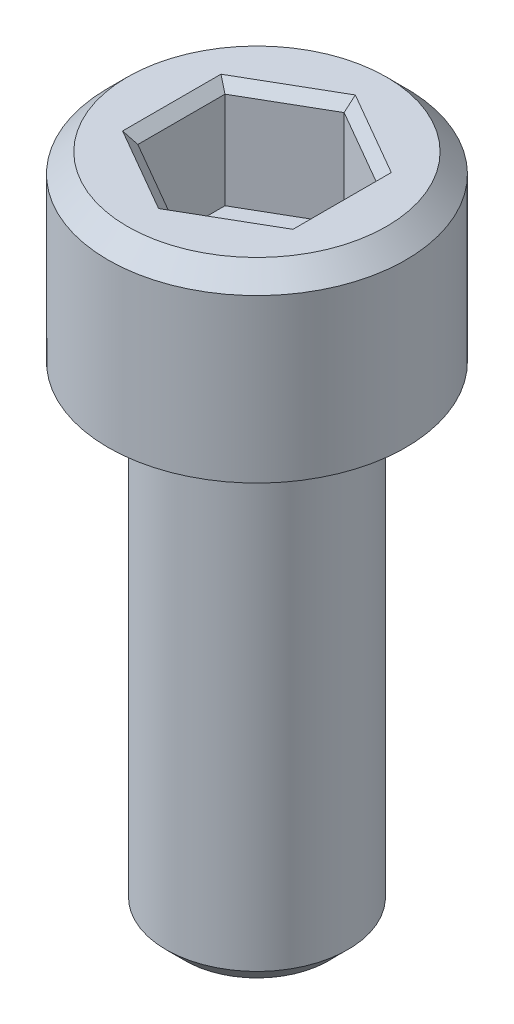
from build123d import *

# Parameters (mm, degrees)
SKETCH1_W           = 3.9116
SKETCH1_H           = 4.7752
SKETCH2_R           = 2.3876
BOSS_EXTRUDE1_DEPTH = 12.7
CUT_EXTRUDE1_DEPTH  = 2.794
CHAMFER1_SIZE       = 0.508
CHAMFER2_SIZE       = 0.254


with BuildPart() as part:
    # Sketch1 → Revolve1 (revolve)
    with BuildSketch(Plane.XY, mode=Mode.PRIVATE) as revolve1_sk:
        with Locations((-1.9558, -2.3876)):
            Rectangle(SKETCH1_W, SKETCH1_H)
    revolve(revolve1_sk.sketch.rotate(Axis((0, -4.7752, 0), (0, 1, 0)), 90), axis=Axis((0, -4.7752, 0), (0, 1, 0)))

    # Sketch2 → Boss-Extrude1 (add)
    with BuildSketch(Plane.XZ.offset(4.7752)):
        with Locations(Location((0, 0, 0), (0, 0, 270))):
            Circle(SKETCH2_R)
    extrude(amount=BOSS_EXTRUDE1_DEPTH)

    # Sketch3 → Cut-Extrude1 (cut)
    with BuildSketch(Plane(origin=(0, 0, 0), x_dir=(-1, 0, 0), z_dir=(0, 1, 0))):
        Polygon((1.984374999, -1.14567944), (1.984374999, 1.14567944), (0, 2.29135888), (-1.984374999, 1.14567944), (-1.984374999, -1.14567944), (0, -2.29135888), align=None)
    extrude(amount=-CUT_EXTRUDE1_DEPTH, mode=Mode.SUBTRACT)

    # Chamfer1
    chamfer1_edges = [part.edges().sort_by_distance(p)[0] for p in [
        (0, 0, -3.9116),
        (0, -17.4752, 2.3876),
    ]]
    chamfer(chamfer1_edges, length=CHAMFER1_SIZE)

    # Chamfer2
    chamfer2_edges = [part.edges().sort_by_distance(p)[0] for p in [
        (-0.9921875, 0, -1.71851916),
        (-1.984374999, 0, 0),
        (-0.9921875, 0, 1.71851916),
        (0.9921875, 0, 1.71851916),
        (1.984374999, 0, 0),
        (0.9921875, 0, -1.71851916),
    ]]
    chamfer(chamfer2_edges, length=CHAMFER2_SIZE)


solid = part.part
